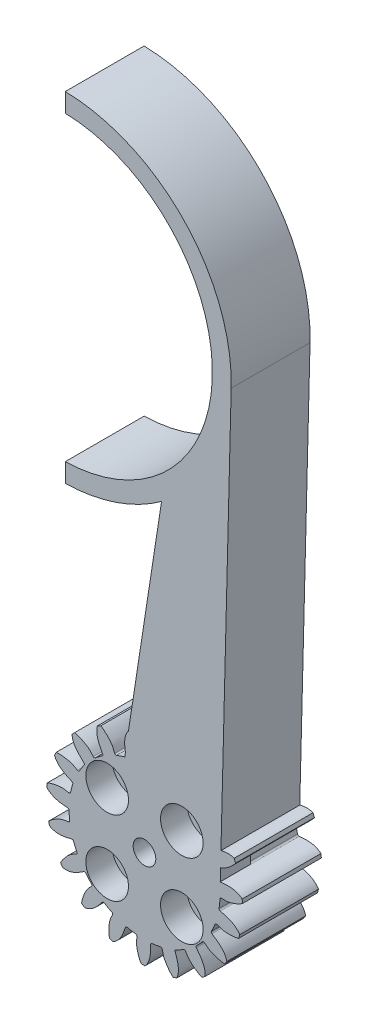
from build123d import *

# Parameters (mm, degrees)
SKETCH_3_R               = 13
SKETCH_3_R_2             = 10
EXTRUDE_1_DEPTH          = 4
CUT_EXTRUDE_2_DEPTH      = 19.814887722
PATTERN_CIRCULAR_4_COUNT = 19
CUT_EXTRUDE_START        = -4
SKETCH_8_R               = 1.5
CUT_EXTRUDE_4_DEPTH      = 4
SKETCH_13_R              = 1.5
EXTRUDE_6_DEPTH          = 6.45
SKETCH_14_R              = 2.825
CUT_EXTRUDE_5_DEPTH      = 3.5
EXTRUDE_START            = -4
EXTRUDE_7_DEPTH          = 4
EXTRUDE_8_DEPTH          = 6.45


with BuildPart() as part:
    # 草图3 → 凸台-拉伸1 (new body)
    # profile 1 of 2: a face of its own
    with BuildSketch(Plane.XY):
        Circle(SKETCH_3_R)
        Circle(SKETCH_3_R_2, mode=Mode.SUBTRACT)
    # profile 2 of 2: a face of its own
    with BuildSketch(Plane.XY):
        Circle(SKETCH_3_R_2)
    extrude(amount=EXTRUDE_1_DEPTH)

    # 草图6 → 切除-拉伸2 (cut, symmetric)
    with BuildSketch(Plane.XY.offset(4)):
        with BuildLine():
            Line((-1.696840499, 12.888783198), (-1.873622587, 14.231576474))
            Line((-1.873622587, 14.231576474), (3.000861464, 14.403965519))
            Line((3.000861464, 14.403965519), (2.084995297, 12.83171051))
            add(Edge.make_bspline(
                [(2.084995297, 12.83171051), (1.471750903, 12.385409064), (1.073531879, 11.424223458), (0.908091171, 10.424013275), (0.866775265, 10.148389403)],
                knots=[0, 0, 0, 0, 0.67611985, 0.94077492, 0.94077492, 0.94077492, 0.94077492], degree=3))
            ThreePointArc((0.866775265, 10.148389403), (0.794461275, 10.022295574), (0.655867727, 9.978468696))
            ThreePointArc((0.655867727, 9.978468696), (0.089873577, 9.999596129), (-0.476408885, 9.988645282))
            ThreePointArc((-0.476408885, 9.988645282), (-0.618800498, 10.03892803), (-0.685447576, 10.174434093))
            add(Edge.make_bspline(
                [(-1.696840499, 12.888783198), (-1.34037548, 12.491366053), (-0.721854022, 11.223575025), (-0.721476087, 10.688451407), (-0.685447576, 10.174434093)],
                knots=[0, 0, 0, 0, 0.6442443, 0.94077492, 0.94077492, 0.94077492, 0.94077492], degree=3))
        make_face()
    cut_extrude_2 = extrude(amount=CUT_EXTRUDE_2_DEPTH, both=True, mode=Mode.SUBTRACT)

    # 阵列(圆周)4: 切除-拉伸2 ×19 about axis
    pattern_circular_4_axis = Axis((0, 0, 4), (0, 0, 1))
    for i in range(1, PATTERN_CIRCULAR_4_COUNT):
        add(cut_extrude_2.rotate(pattern_circular_4_axis, i * 360 / PATTERN_CIRCULAR_4_COUNT), mode=Mode.SUBTRACT)

    # 草图8 → 切除-拉伸4 (cut)
    with BuildSketch(Plane(origin=(0, 0, 0), x_dir=(-1, 0, 0), z_dir=(0, 0, -1)).offset(CUT_EXTRUDE_START)):
        Circle(SKETCH_8_R)
        with Locations((-4.949747468, 4.949747468)):
            Circle(SKETCH_8_R)
        with Locations((-4.949747468, -4.949747468)):
            Circle(SKETCH_8_R)
        with Locations((4.949747468, -4.949747468)):
            Circle(SKETCH_8_R)
        with Locations((4.949747468, 4.949747468)):
            Circle(SKETCH_8_R)
    extrude(amount=CUT_EXTRUDE_4_DEPTH, mode=Mode.SUBTRACT)

    # 草图13 → 凸台-拉伸6 (add)
    with BuildSketch(Plane(origin=(0, 0, 0), x_dir=(-1, 0, 0), z_dir=(0, 0, -1))):
        with BuildLine():
            ThreePointArc((2.475365662, 9.879963141), (2.502818882, 9.73722111), (2.619672484, 9.650767642))
            ThreePointArc((2.619672484, 9.650767642), (3.161859577, 9.486972331), (3.693903558, 9.292743217))
            ThreePointArc((3.693903558, 9.292743217), (3.844906783, 9.294067025), (3.951941485, 9.400590726))
            add(Edge.make_bspline(
                [(5.789882063, 11.639470164), (5.323690166, 11.379330179), (4.327030833, 10.381065154), (4.152919021, 9.875058725), (3.951941485, 9.400590726)],
                knots=[0, 0, 0, 0, 0.6442443, 0.94077492, 0.94077492, 0.94077492, 0.94077492], degree=3))
            ThreePointArc((5.789882063, 11.639470164), (6.014090471, 11.525220857), (6.23604547, 11.406653186))
            add(Edge.make_bspline(
                [(5.54926231, 8.540889569), (5.685949941, 8.783772287), (6.169735786, 9.674694447), (6.445857441, 10.677796132), (6.23604547, 11.406653186)],
                knots=[0, 0, 0, 0, 0.26465507, 0.94077492, 0.94077492, 0.94077492, 0.94077492], degree=3))
            ThreePointArc((5.54926231, 8.540889569), (5.528879777, 8.39696765), (5.611330534, 8.277256166))
            ThreePointArc((5.611330534, 8.277256166), (6.070956184, 7.946287876), (6.511106465, 7.589828233))
            ThreePointArc((6.511106465, 7.589828233), (6.654357758, 7.542049646), (6.790181214, 7.608047488))
            add(Edge.make_bspline(
                [(9.255500067, 9.128839932), (8.730100418, 9.034167311), (7.463306713, 8.413605795), (7.13432874, 7.991550203), (6.790181214, 7.608047488)],
                knots=[0, 0, 0, 0, 0.6442443, 0.94077492, 0.94077492, 0.94077492, 0.94077492], degree=3))
            ThreePointArc((9.255500067, 9.128839932), (9.430463555, 8.947980617), (9.60189356, 8.763768599))
            add(Edge.make_bspline(
                [(8.021810282, 6.276278088), (8.229955689, 6.461618348), (8.976810635, 7.147182881), (9.563677842, 8.006277195), (9.60189356, 8.763768599)],
                knots=[0, 0, 0, 0, 0.26465507, 0.94077492, 0.94077492, 0.94077492, 0.94077492], degree=3))
            ThreePointArc((8.021810282, 6.276278088), (7.955800759, 6.146772452), (7.994913852, 6.00677555))
            ThreePointArc((7.994913852, 6.00677555), (8.322170488, 5.54449983), (8.622729956, 5.064437591))
            ThreePointArc((8.622729956, 5.064437591), (8.742705817, 4.972734162), (8.892599447, 4.991054254))
            add(Edge.make_bspline(
                [(11.718141024, 5.628958246), (11.190468827, 5.710012235), (9.790817505, 5.534401698), (9.342623239, 5.242033215), (8.892599447, 4.991054254)],
                knots=[0, 0, 0, 0, 0.6442443, 0.94077492, 0.94077492, 0.94077492, 0.94077492], degree=3))
            ThreePointArc((11.718141024, 5.628958246), (11.824899585, 5.401087836), (11.927227495, 5.171193701))
            add(Edge.make_bspline(
                [(9.625070638, 3.331534489), (9.882118037, 3.439247799), (10.811108762, 3.84516315), (11.645125353, 4.467153894), (11.927227495, 5.171193701)],
                knots=[0, 0, 0, 0, 0.26465507, 0.94077492, 0.94077492, 0.94077492, 0.94077492], degree=3))
            ThreePointArc((9.625070638, 3.331534489), (9.520587282, 3.230479082), (9.512124199, 3.085367598))
            ThreePointArc((9.512124199, 3.085367598), (9.671548488, 2.541879196), (9.79994686, 1.990236553))
            ThreePointArc((9.79994686, 1.990236553), (9.883646043, 1.86454577), (10.031366548, 1.833202847))
            add(Edge.make_bspline(
                [(12.910939576, 1.519091591), (12.438176302, 1.767088734), (11.0573413, 2.055459301), (10.538499545, 1.924460589), (10.031366548, 1.833202847)],
                knots=[0, 0, 0, 0, 0.6442443, 0.94077492, 0.94077492, 0.94077492, 0.94077492], degree=3))
            ThreePointArc((12.910939576, 1.519091591), (12.937924262, 1.26890338), (12.96006126, 1.018239726))
            add(Edge.make_bspline(
                [(10.185305242, 0.025767433), (10.463399559, 0.044181386), (11.473855503, 0.126460328), (12.464642839, 0.443945154), (12.96006126, 1.018239726)],
                knots=[0, 0, 0, 0, 0.26465507, 0.94077492, 0.94077492, 0.94077492, 0.94077492], degree=3))
            ThreePointArc((10.185305242, 0.025767433), (10.053670446, -0.035886822), (9.998548294, -0.170387807))
            ThreePointArc((9.998548294, -0.170387807), (9.972864139, -0.736193491), (9.915187461, -1.299637496))
            ThreePointArc((9.915187461, -1.299637496), (9.953539861, -1.445695087), (10.08307943, -1.523304533))
            add(Edge.make_bspline(
                [(12.704637491, -2.755392209), (12.338014375, -2.367326251), (11.125630593, -1.646224004), (10.592365903, -1.601657202), (10.08307943, -1.523304533)],
                knots=[0, 0, 0, 0, 0.6442443, 0.94077492, 0.94077492, 0.94077492, 0.94077492], degree=3))
            ThreePointArc((12.704637491, -2.755392209), (12.648924093, -3.000786445), (12.588471292, -3.245056323))
            add(Edge.make_bspline(
                [(9.641803982, -3.282791923), (9.910809382, -3.355672766), (10.893231964, -3.605946433), (11.933422864, -3.627371933), (12.588471292, -3.245056323)],
                knots=[0, 0, 0, 0, 0.26465507, 0.94077492, 0.94077492, 0.94077492, 0.94077492], degree=3))
            ThreePointArc((9.641803982, -3.282791923), (9.497282418, -3.298363832), (9.401474538, -3.40767905))
            ThreePointArc((9.401474538, -3.40767905), (9.193465217, -3.934488189), (8.95596365, -4.448675658))
            ThreePointArc((8.95596365, -4.448675658), (8.944813189, -4.599272449), (9.042134201, -4.714738231))
            add(Edge.make_bspline(
                [(11.121590801, -6.731286508), (10.900837147, -6.245204703), (9.988285179, -5.169513395), (9.498385058, -4.954210583), (9.042134201, -4.714738231)],
                knots=[0, 0, 0, 0, 0.6442443, 0.94077492, 0.94077492, 0.94077492, 0.94077492], degree=3))
            ThreePointArc((11.121590801, -6.731286508), (10.98921673, -6.945294498), (10.852725129, -7.156700167))
            add(Edge.make_bspline(
                [(8.053463652, -6.235609836), (8.284229227, -6.391887706), (9.132157717, -6.947592946), (10.109031356, -7.305606986), (10.852725129, -7.156700167)],
                knots=[0, 0, 0, 0, 0.26465507, 0.94077492, 0.94077492, 0.94077492, 0.94077492], degree=3))
            ThreePointArc((8.053463652, -6.235609836), (7.911716475, -6.203411942), (7.785605137, -6.275695392))
            ThreePointArc((7.785605137, -6.275695392), (7.417811686, -6.706420043), (7.026222211, -7.115630783))
            ThreePointArc((7.026222211, -7.115630783), (6.966777215, -7.254447276), (7.021333428, -7.395256884))
            add(Edge.make_bspline(
                [(8.333347178, -9.977741468), (8.282385071, -9.446318322), (7.768554082, -8.132605796), (7.37510681, -7.769898375), (7.021333428, -7.395256884)],
                knots=[0, 0, 0, 0, 0.6442443, 0.94077492, 0.94077492, 0.94077492, 0.94077492], degree=3))
            ThreePointArc((8.333347178, -9.977741468), (8.138657219, -10.137172124), (7.940917801, -10.2928045))
            add(Edge.make_bspline(
                [(5.592405573, -8.512702669), (5.759924291, -8.735442432), (6.381472481, -9.53635996), (7.189169443, -10.192166164), (7.940917801, -10.2928045)],
                knots=[0, 0, 0, 0, 0.26465507, 0.94077492, 0.94077492, 0.94077492, 0.94077492], degree=3))
            ThreePointArc((5.592405573, -8.512702669), (5.468793288, -8.436224112), (5.326044613, -8.463642761))
            ThreePointArc((5.326044613, -8.463642761), (4.838323161, -8.751607223), (4.335080573, -9.011496903))
            ThreePointArc((4.335080573, -9.011496903), (4.233782829, -9.123490176), (4.239662231, -9.274384705))
            add(Edge.make_bspline(
                [(4.642056084, -12.142953319), (4.766408057, -11.623776776), (4.706979609, -10.214404169), (4.452621302, -9.743597116), (4.239662231, -9.274384705)],
                knots=[0, 0, 0, 0, 0.6442443, 0.94077492, 0.94077492, 0.94077492, 0.94077492], degree=3))
            ThreePointArc((4.642056084, -12.142953319), (4.406147914, -12.230529856), (4.168588813, -12.313523757))
            add(Edge.make_bspline(
                [(2.525323576, -9.867312079), (2.611442185, -10.132376426), (2.939255683, -11.0917144), (3.490249469, -11.97424599), (4.168588813, -12.313523757)],
                knots=[0, 0, 0, 0, 0.26465507, 0.94077492, 0.94077492, 0.94077492, 0.94077492], degree=3))
            ThreePointArc((2.525323576, -9.867312079), (2.433241492, -9.754840498), (2.289324513, -9.734423109))
            ThreePointArc((2.289324513, -9.734423109), (1.734527246, -9.848421967), (1.174165689, -9.930827505))
            ThreePointArc((1.174165689, -9.930827505), (1.04199238, -10.00386135), (0.998557846, -10.148489036))
            add(Edge.make_bspline(
                [(0.447726184, -12.992287761), (0.733916772, -12.541618654), (1.135330859, -11.189313357), (1.047625186, -10.661425922), (0.998557846, -10.148489036)],
                knots=[0, 0, 0, 0, 0.6442443, 0.94077492, 0.94077492, 0.94077492, 0.94077492], degree=3))
            ThreePointArc((0.447726184, -12.992287761), (0.196164114, -12.998519902), (-0.055471455, -12.99988165))
            add(Edge.make_bspline(
                [(-0.815416416, -10.152645118), (-0.820030203, -10.431310214), (-0.821475076, -11.44510948), (-0.586893191, -12.458730464), (-0.055471455, -12.99988165)],
                knots=[0, 0, 0, 0, 0.26465507, 0.94077492, 0.94077492, 0.94077492, 0.94077492], degree=3))
            ThreePointArc((-0.815416416, -10.152645118), (-0.865989775, -10.016368554), (-0.99547942, -9.950327669))
            ThreePointArc((-0.99547942, -9.950327669), (-1.55723161, -9.878007376), (-2.113988266, -9.773998855))
            ThreePointArc((-2.113988266, -9.773998855), (-2.262714112, -9.800158922), (-2.350755776, -9.922847111))
            add(Edge.make_bspline(
                [(-3.795121796, -12.433706228), (-3.378105783, -12.100381549), (-2.559348607, -10.951686823), (-2.470897374, -10.4239238), (-2.350755776, -9.922847111)],
                knots=[0, 0, 0, 0, 0.6442443, 0.94077492, 0.94077492, 0.94077492, 0.94077492], degree=3))
            ThreePointArc((-3.795121796, -12.433706228), (-4.035077111, -12.357918624), (-4.27352053, -12.277500653))
            add(Edge.make_bspline(
                [(-4.067793386, -9.337781524), (-4.162639595, -9.599849683), (-4.493186263, -10.558249358), (-4.600436868, -11.593118175), (-4.27352053, -12.277500653)],
                knots=[0, 0, 0, 0, 0.26465507, 0.94077492, 0.94077492, 0.94077492, 0.94077492], degree=3))
            ThreePointArc((-4.067793386, -9.337781524), (-4.071377613, -9.192467657), (-4.172407712, -9.087959831))
            ThreePointArc((-4.172407712, -9.087959831), (-4.680240257, -8.837157412), (-5.173058791, -8.558005769))
            ThreePointArc((-5.173058791, -8.558005769), (-5.32222042, -8.534457208), (-5.445328533, -8.621910731))
            add(Edge.make_bspline(
                [(-7.626709441, -10.527739696), (-7.12405816, -10.347880345), (-5.976682938, -9.527275089), (-5.721659864, -9.05682779), (-5.445328533, -8.621910731)],
                knots=[0, 0, 0, 0, 0.6442443, 0.94077492, 0.94077492, 0.94077492, 0.94077492], degree=3))
            ThreePointArc((-7.626709441, -10.527739696), (-7.829055121, -10.37814511), (-8.028467345, -10.224661955))
            add(Edge.make_bspline(
                [(-6.879361825, -7.511024412), (-7.054162396, -7.728096481), (-7.677991, -8.52723909), (-8.115451827, -9.471211646), (-8.028467345, -10.224661955)],
                knots=[0, 0, 0, 0, 0.26465507, 0.94077492, 0.94077492, 0.94077492, 0.94077492], degree=3))
            ThreePointArc((-6.879361825, -7.511024412), (-6.835568513, -7.372420254), (-6.897190887, -7.24077053))
            ThreePointArc((-6.897190887, -7.24077053), (-7.296072252, -6.838664321), (-7.671548128, -6.414619967))
            ThreePointArc((-7.671548128, -6.414619967), (-7.804981563, -6.343914631), (-7.949815452, -6.386656542))
            add(Edge.make_bspline(
                [(-10.631824778, -7.480929213), (-10.098008294, -7.474025743), (-8.746350935, -7.070435268), (-8.352391726, -6.708283958), (-7.949815452, -6.386656542)],
                knots=[0, 0, 0, 0, 0.6442443, 0.94077492, 0.94077492, 0.94077492, 0.94077492], degree=3))
            ThreePointArc((-10.631824778, -7.480929213), (-10.774633528, -7.27373854), (-10.913405149, -7.063822482))
            add(Edge.make_bspline(
                [(-8.945444665, -4.870331258), (-9.181257245, -5.018884111), (-10.030766276, -5.572170153), (-10.751031656, -6.322952374), (-10.913405149, -7.063822482)],
                knots=[0, 0, 0, 0, 0.26465507, 0.94077492, 0.94077492, 0.94077492, 0.94077492], degree=3))
            ThreePointArc((-8.945444665, -4.870331258), (-8.8590195, -4.753456721), (-8.874556408, -4.608931391))
            ThreePointArc((-8.874556408, -4.608931391), (-9.121261608, -4.099095838), (-9.338706188, -3.576110559))
            ThreePointArc((-9.338706188, -3.576110559), (-9.441951847, -3.465910467), (-9.592816512, -3.459309017))
            add(Edge.make_bspline(
                [(-12.48481693, -3.623443971), (-11.977682543, -3.790244479), (-10.568216095, -3.847404077), (-10.078012345, -3.63279347), (-9.592816512, -3.459309017)],
                knots=[0, 0, 0, 0, 0.6442443, 0.94077492, 0.94077492, 0.94077492, 0.94077492], degree=3))
            ThreePointArc((-12.48481693, -3.623443971), (-12.552613207, -3.381109535), (-12.615706166, -3.137508236))
            add(Edge.make_bspline(
                [(-10.042149774, -1.701862142), (-10.31342041, -1.765797772), (-11.296552383, -2.013270119), (-12.221570386, -2.489503102), (-12.615706166, -3.137508236)],
                knots=[0, 0, 0, 0, 0.26465507, 0.94077492, 0.94077492, 0.94077492, 0.94077492], degree=3))
            ThreePointArc((-10.042149774, -1.701862142), (-9.922458262, -1.619382395), (-9.890226039, -1.47764302))
            ThreePointArc((-9.890226039, -1.47764302), (-9.958020737, -0.915326716), (-9.993870528, -0.350074083))
            ThreePointArc((-9.993870528, -0.350074083), (-10.055740141, -0.212321125), (-10.196287055, -0.157091683))
            add(Edge.make_bspline(
                [(-12.984885446, 0.626697648), (-12.559389035, 0.304268585), (-11.244851058, -0.207446955), (-10.711523949, -0.16363344), (-10.196287055, -0.157091683)],
                knots=[0, 0, 0, 0, 0.6442443, 0.94077492, 0.94077492, 0.94077492, 0.94077492], degree=3))
            ThreePointArc((-12.984885446, 0.626697648), (-12.97032247, 0.877915151), (-12.950899667, 1.12880371))
            add(Edge.make_bspline(
                [(-10.050632134, 1.651030144), (-10.327964444, 1.678640154), (-11.338181754, 1.763798972), (-12.367712328, 1.61372246), (-12.950899667, 1.12880371)],
                knots=[0, 0, 0, 0, 0.26465507, 0.94077492, 0.94077492, 0.94077492, 0.94077492], degree=3))
            ThreePointArc((-10.050632134, 1.651030144), (-9.910644708, 1.69017714), (-9.834136216, 1.8137709))
            ThreePointArc((-9.834136216, 1.8137709), (-9.715673805, 2.367632258), (-9.566043926, 2.913898353))
            ThreePointArc((-9.566043926, 2.913898353), (-9.57983296, 3.064276505), (-9.694831684, 3.162148972))
            add(Edge.make_bspline(
                [(-12.077840143, 4.808926853), (-11.780090846, 4.365809427), (-10.702931927, 3.454990263), (-10.184275727, 3.323258811), (-9.694831684, 3.162148972)],
                knots=[0, 0, 0, 0, 0.6442443, 0.94077492, 0.94077492, 0.94077492, 0.94077492], degree=3))
            ThreePointArc((-12.077840143, 4.808926853), (-11.982496039, 5.041804108), (-11.882662235, 5.272792259))
            add(Edge.make_bspline(
                [(-8.969972551, 4.825007696), (-9.223313276, 4.941171373), (-10.151143203, 5.349733076), (-11.173620733, 5.542076154), (-11.882662235, 5.272792259)],
                knots=[0, 0, 0, 0, 0.26465507, 0.94077492, 0.94077492, 0.94077492, 0.94077492], degree=3))
            ThreePointArc((-8.969972551, 4.825007696), (-8.824859021, 4.816579757), (-8.712365142, 4.908634599))
            ThreePointArc((-8.712365142, 4.908634599), (-8.420482862, 5.394021539), (-8.101588032, 5.862104687))
            ThreePointArc((-8.101588032, 5.862104687), (-8.065802231, 6.008812229), (-8.142790869, 6.138721721))
            add(Edge.make_bspline(
                [(-9.861973453, 8.470034215), (-9.724237028, 7.954247075), (-9.001184049, 6.743025677), (-8.553403205, 6.450024405), (-8.142790869, 6.138721721)],
                knots=[0, 0, 0, 0, 0.6442443, 0.94077492, 0.94077492, 0.94077492, 0.94077492], degree=3))
            ThreePointArc((-9.861973453, 8.470034215), (-9.696180235, 8.659335359), (-9.526753972, 8.845391951))
            add(Edge.make_bspline(
                [(-6.917277258, 7.476120796), (-7.119173, 7.668250004), (-7.864070774, 8.355940591), (-8.768693956, 8.869859903), (-9.526753972, 8.845391951)],
                knots=[0, 0, 0, 0, 0.26465507, 0.94077492, 0.94077492, 0.94077492, 0.94077492], degree=3))
            ThreePointArc((-6.917277258, 7.476120796), (-6.782762927, 7.42103122), (-6.646474119, 7.471571574))
            ThreePointArc((-6.646474119, 7.471571574), (-6.212801944, 7.83588489), (-5.759199365, 8.17506102))
            ThreePointArc((-5.759199365, 8.17506102), (-5.677716677, 8.302199912), (-5.708352315, 8.450068718))
            add(Edge.make_bspline(
                [(-6.577408916, 11.213281944), (-6.61461124, 10.68071863), (-6.324018211, 9.300349629), (-5.995636726, 8.877829772), (-5.708352315, 8.450068718)],
                knots=[0, 0, 0, 0, 0.6442443, 0.94077492, 0.94077492, 0.94077492, 0.94077492], degree=3))
            ThreePointArc((-6.577408916, 11.213281944), (-6.35913285, 11.338493259), (-6.138474093, 11.459456174))
            add(Edge.make_bspline(
                [(-4.114987643, 9.317080204), (-4.243559864, 9.564354762), (-4.724804254, 10.456652288), (-5.413543129, 11.236456701), (-6.138474093, 11.459456174)],
                knots=[0, 0, 0, 0, 0.26465507, 0.94077492, 0.94077492, 0.94077492, 0.94077492], degree=3))
            ThreePointArc((-4.114987643, 9.317080204), (-4.005649225, 9.221298802), (-3.860334494, 9.224847836))
            ThreePointArc((-3.860334494, 9.224847836), (-3.331867534, 9.428608526), (-2.792712084, 9.602122641))
            ThreePointArc((-2.792712084, 9.602122641), (-2.674362422, 9.695915412), (-2.655325214, 9.845719654))
            add(Edge.make_bspline(
                [(-2.580080063, 12.741396582), (-2.788189688, 12.249768592), (-2.961546873, 10.84983639), (-2.788149975, 10.34358453), (-2.655325214, 9.845719654)],
                knots=[0, 0, 0, 0, 0.6442443, 0.94077492, 0.94077492, 0.94077492, 0.94077492], degree=3))
            ThreePointArc((-2.580080063, 12.741396582), (-2.332974749, 12.788949481), (-2.084995297, 12.83171051))
            add(Edge.make_bspline(
                [(-0.866775265, 10.148389403), (-0.908091171, 10.424013275), (-1.073531879, 11.424223458), (-1.471750903, 12.385409064), (-2.084995297, 12.83171051)],
                knots=[0, 0, 0, 0, 0.26465507, 0.94077492, 0.94077492, 0.94077492, 0.94077492], degree=3))
            ThreePointArc((-0.866775265, 10.148389403), (-0.794461275, 10.022295574), (-0.655867727, 9.978468696))
            ThreePointArc((-0.655867727, 9.978468696), (-0.089873577, 9.999596129), (0.476408885, 9.988645282))
            ThreePointArc((0.476408885, 9.988645282), (0.618800498, 10.03892803), (0.685447576, 10.174434093))
            add(Edge.make_bspline(
                [(1.696840499, 12.888783198), (1.34037548, 12.491366053), (0.721854022, 11.223575025), (0.721476087, 10.688451407), (0.685447576, 10.174434093)],
                knots=[0, 0, 0, 0, 0.6442443, 0.94077492, 0.94077492, 0.94077492, 0.94077492], degree=3))
            ThreePointArc((1.696840499, 12.888783198), (1.945997366, 12.853524585), (2.194425091, 12.813449907))
            add(Edge.make_bspline(
                [(2.475365662, 9.879963141), (2.525783291, 10.154068204), (2.694074332, 11.153802751), (2.629528369, 12.192210175), (2.194425091, 12.813449907)],
                knots=[0, 0, 0, 0, 0.26465507, 0.94077492, 0.94077492, 0.94077492, 0.94077492], degree=3))
        make_face()
        with Locations((-4.949747468, -4.949747468)):
            Circle(SKETCH_13_R, mode=Mode.SUBTRACT)
        with Locations((4.949747468, -4.949747468)):
            Circle(SKETCH_13_R, mode=Mode.SUBTRACT)
        with Locations((4.949747468, 4.949747468)):
            Circle(SKETCH_13_R, mode=Mode.SUBTRACT)
        Circle(SKETCH_13_R, mode=Mode.SUBTRACT)
        with Locations((-4.949747468, 4.949747468)):
            Circle(SKETCH_13_R, mode=Mode.SUBTRACT)
    extrude(amount=EXTRUDE_6_DEPTH)

    # 草图14 → 切除-拉伸5 (cut)
    with BuildSketch(Plane.XY.offset(4)):
        with Locations((4.949747468, -4.949747468)):
            Circle(SKETCH_14_R)
        with Locations((-4.949747468, -4.949747468)):
            Circle(SKETCH_14_R)
        with Locations((-4.949747468, 4.949747468)):
            Circle(SKETCH_14_R)
        with Locations((4.949747468, 4.949747468)):
            Circle(SKETCH_14_R)
    extrude(amount=-CUT_EXTRUDE_5_DEPTH, mode=Mode.SUBTRACT)

    # 草图9 → 凸台-拉伸7 (add)
    with BuildSketch(Plane(origin=(0, 0, 0), x_dir=(-1, 0, 0), z_dir=(0, 0, -1)).offset(EXTRUDE_START)):
        with BuildLine():
            Line((-11.492809903, 59.034961876), (-10, 0))
            ThreePointArc((-10, 0), (-6.074671808, 7.943447767), (2.619672484, 9.650767642))
            Line((2.619672484, 9.650767642), (-2.262382091, 41.42794815))
            ThreePointArc((-2.262382091, 41.42794815), (3.787962149, 38.290909812), (10.5, 37.109291067))
            Line((10.5, 37.109291067), (10.5, 39.609985802))
            ThreePointArc((10.5, 39.609985802), (-9, 59.603734826), (10.5, 79.597483849))
            Line((10.5, 79.597483849), (10.5, 82.098178584))
            ThreePointArc((10.5, 82.098178584), (-5.283283392, 75.131280735), (-11.492809903, 59.034961876))
        make_face()
    extrude(amount=EXTRUDE_7_DEPTH)

    # 草图15 → 凸台-拉伸8 (add)
    with BuildSketch(Plane(origin=(0, 0, 0), x_dir=(-1, 0, 0), z_dir=(0, 0, -1))):
        with BuildLine():
            Line((10.5, 37.109291067), (10.5, 39.609985802))
            ThreePointArc((10.5, 39.609985802), (-9, 59.603734826), (10.5, 79.597483849))
            Line((10.5, 79.597483849), (10.5, 82.098178584))
            ThreePointArc((10.5, 82.098178584), (-5.283283392, 75.131280735), (-11.492809903, 59.034961876))
            Line((-11.492809903, 59.034961876), (-10.133463712, 5.277982898))
            add(Edge.make_bspline(
                [(-10.133463712, 5.277982898), (-10.005256434, 5.241568871), (-9.606224769, 5.109783063), (-9.223313276, 4.941171373), (-8.969972551, 4.825007696)],
                knots=[0, 0, 0, 0, 0.123598768, 0.388253837, 0.388253837, 0.388253837, 0.388253837], degree=3))
            ThreePointArc((-8.969972551, 4.825007696), (-8.824859021, 4.816579757), (-8.712365142, 4.908634599))
            ThreePointArc((-8.712365142, 4.908634599), (-8.420482862, 5.394021539), (-8.101588032, 5.862104687))
            ThreePointArc((-8.101588032, 5.862104687), (-8.065802231, 6.008812229), (-8.142790869, 6.138721721))
            add(Edge.make_bspline(
                [(-8.142790869, 6.138721721), (-8.553403205, 6.450024405), (-9.001184049, 6.743025677), (-9.724237028, 7.954247075), (-9.861973453, 8.470034215)],
                knots=[0, 0, 0, 0, 0.29653062, 0.94077492, 0.94077492, 0.94077492, 0.94077492], degree=3))
            ThreePointArc((-9.861973453, 8.470034215), (-9.696180235, 8.659335359), (-9.526753972, 8.845391951))
            add(Edge.make_bspline(
                [(-9.526753972, 8.845391951), (-8.768693956, 8.869859903), (-7.864070774, 8.355940591), (-7.119173, 7.668250004), (-6.917277258, 7.476120796)],
                knots=[0, 0, 0, 0, 0.67611985, 0.94077492, 0.94077492, 0.94077492, 0.94077492], degree=3))
            ThreePointArc((-6.917277258, 7.476120796), (-6.782762927, 7.42103122), (-6.646474119, 7.471571574))
            ThreePointArc((-6.646474119, 7.471571574), (-6.212801944, 7.83588489), (-5.759199365, 8.17506102))
            ThreePointArc((-5.759199365, 8.17506102), (-5.677716677, 8.302199912), (-5.708352315, 8.450068718))
            add(Edge.make_bspline(
                [(-5.708352315, 8.450068718), (-5.995636726, 8.877829772), (-6.324018211, 9.300349629), (-6.61461124, 10.68071863), (-6.577408916, 11.213281944)],
                knots=[0, 0, 0, 0, 0.29653062, 0.94077492, 0.94077492, 0.94077492, 0.94077492], degree=3))
            ThreePointArc((-6.577408916, 11.213281944), (-6.35913285, 11.338493259), (-6.138474093, 11.459456174))
            add(Edge.make_bspline(
                [(-6.138474093, 11.459456174), (-5.413543129, 11.236456701), (-4.724804254, 10.456652288), (-4.243559864, 9.564354762), (-4.114987643, 9.317080204)],
                knots=[0, 0, 0, 0, 0.67611985, 0.94077492, 0.94077492, 0.94077492, 0.94077492], degree=3))
            ThreePointArc((-4.114987643, 9.317080204), (-4.005649225, 9.221298802), (-3.860334494, 9.224847836))
            ThreePointArc((-3.860334494, 9.224847836), (-3.331867534, 9.428608526), (-2.792712084, 9.602122641))
            ThreePointArc((-2.792712084, 9.602122641), (-2.674362422, 9.695915412), (-2.655325214, 9.845719654))
            add(Edge.make_bspline(
                [(-2.655325214, 9.845719654), (-2.788149975, 10.34358453), (-2.961546873, 10.84983639), (-2.788189688, 12.249768592), (-2.580080063, 12.741396582)],
                knots=[0, 0, 0, 0, 0.29653062, 0.94077492, 0.94077492, 0.94077492, 0.94077492], degree=3))
            ThreePointArc((-2.580080063, 12.741396582), (-2.332974749, 12.788949481), (-2.084995297, 12.83171051))
            add(Edge.make_bspline(
                [(-2.084995297, 12.83171051), (-1.471750903, 12.385409064), (-1.073531879, 11.424223458), (-0.908091171, 10.424013275), (-0.866775265, 10.148389403)],
                knots=[0, 0, 0, 0, 0.67611985, 0.94077492, 0.94077492, 0.94077492, 0.94077492], degree=3))
            ThreePointArc((-0.866775265, 10.148389403), (-0.794461275, 10.022295574), (-0.655867727, 9.978468696))
            ThreePointArc((-0.655867727, 9.978468696), (-0.089873577, 9.999596129), (0.476408885, 9.988645282))
            ThreePointArc((0.476408885, 9.988645282), (0.618800498, 10.03892803), (0.685447576, 10.174434093))
            add(Edge.make_bspline(
                [(0.685447576, 10.174434093), (0.721476087, 10.688451407), (0.721854022, 11.223575025), (1.34037548, 12.491366053), (1.696840499, 12.888783198)],
                knots=[0, 0, 0, 0, 0.29653062, 0.94077492, 0.94077492, 0.94077492, 0.94077492], degree=3))
            ThreePointArc((1.696840499, 12.888783198), (1.914775976, 12.858212666), (2.132162734, 12.823957348))
            Line((2.132162734, 12.823957348), (-2.262382091, 41.42794815))
            ThreePointArc((-2.262382091, 41.42794815), (3.787962149, 38.290909812), (10.5, 37.109291067))
        make_face()
    extrude(amount=EXTRUDE_8_DEPTH)


solid = part.part
